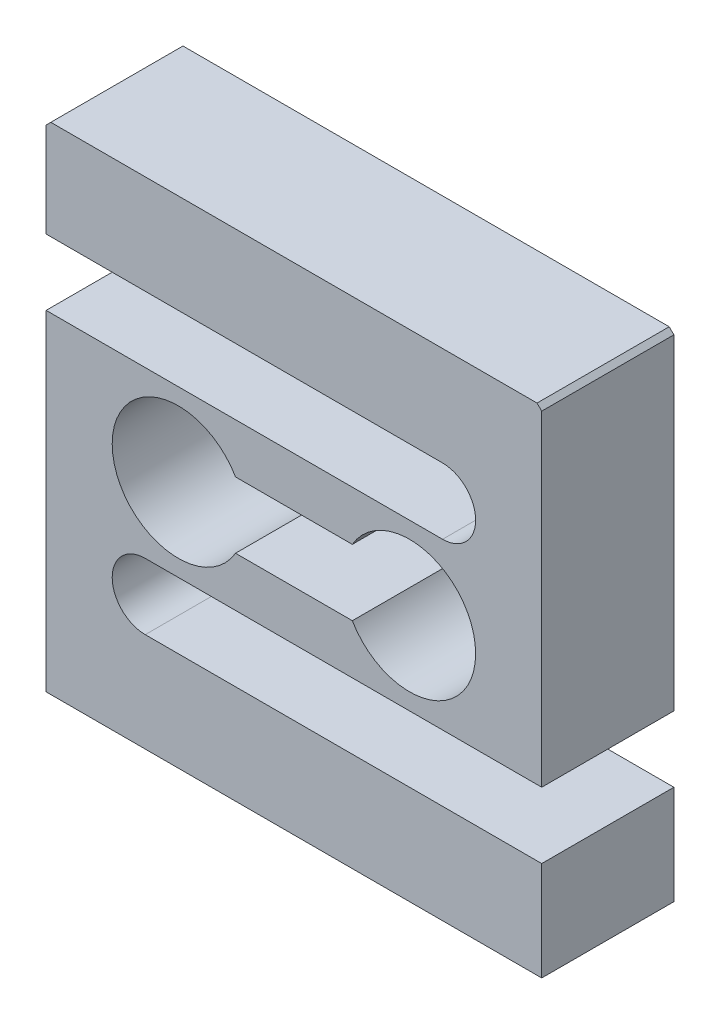
from build123d import *

# Parameters (mm, degrees)
BOSS_EXTRU_1_DEPTH      = 20
ENL_V_MAT_EXTRU_3_DEPTH = 108.935165725


with BuildPart() as part:
    # Esquisse1 → Boss.-Extru.1 (new body)
    with BuildSketch(Plane.XY):
        with BuildLine():
            Line((0, 50), (0, 0))
            Line((0, 0), (75, 0))
            Line((75, 0), (75, 15))
            Line((75, 15), (15, 15))
            ThreePointArc((15, 15), (10, 20), (15, 25))
            Line((15, 25), (75, 25))
            Line((75, 25), (75, 74.292893219))
            Line((75, 74.292893219), (74.292893219, 75))
            Line((74.292893219, 75), (0.707106781, 75))
            Line((0.707106781, 75), (0, 74.292893219))
            Line((0, 74.292893219), (0, 60))
            Line((0, 60), (60, 60))
            ThreePointArc((60, 60), (65, 55), (60, 50))
            Line((60, 50), (0, 50))
        make_face()
    extrude(amount=BOSS_EXTRU_1_DEPTH)

    # Esquisse2 → Enlèv. mat.-Extru.3 (cut, through all)
    with BuildSketch(Plane.XY):
        with BuildLine():
            Line((28.660254038, 42.5), (46.339745962, 42.5))
            ThreePointArc((46.339745962, 42.5), (65, 37.5), (46.339745962, 32.5))
            Line((46.339745962, 32.5), (28.660254038, 32.5))
            ThreePointArc((28.660254038, 32.5), (10, 37.5), (28.660254038, 42.5))
        make_face()
    extrude(amount=ENL_V_MAT_EXTRU_3_DEPTH, mode=Mode.SUBTRACT)


solid = part.part
